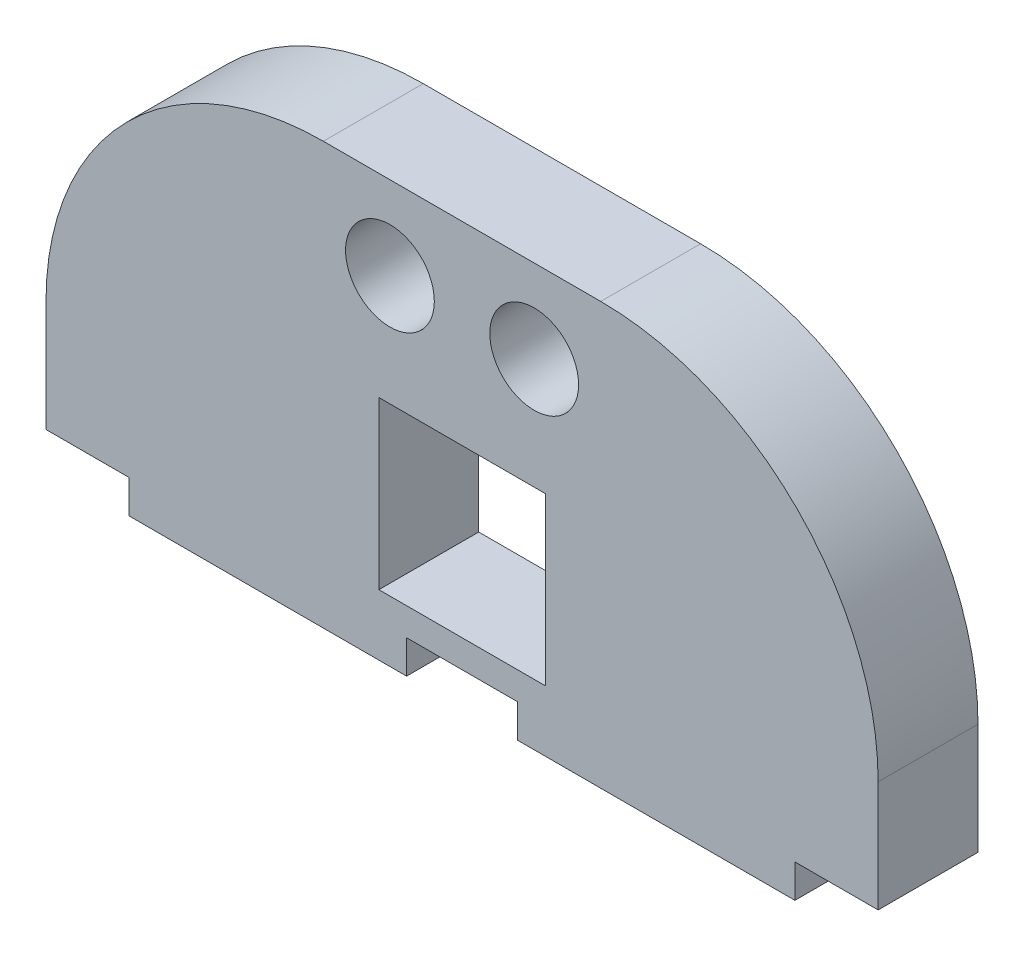
from build123d import *

# Parameters (mm, degrees)
ESQUISSE1_R        = 8
ESQUISSE1_W        = 30
ESQUISSE1_H        = 30
BOSS_EXTRU_1_DEPTH = 18


with BuildPart() as part:
    # Esquisse1 → Boss.-Extru.1 (new body)
    with BuildSketch(Plane.XY):
        with BuildLine():
            Line((0, 0), (0, 20))
            ThreePointArc((0, 20), (14.644660941, 55.355339059), (50, 70))
            Line((50, 70), (100, 70))
            ThreePointArc((100, 70), (135.355339059, 55.355339059), (150, 20))
            Line((150, 20), (150, 0))
            Line((150, 0), (135, 0))
            Line((135, 0), (135, -6))
            Line((135, -6), (85, -6))
            Line((85, -6), (85, 0))
            Line((85, 0), (65, 0))
            Line((65, 0), (65, -6))
            Line((65, -6), (15, -6))
            Line((15, -6), (15, 0))
            Line((15, 0), (0, 0))
        make_face()
        with Locations((62, 55)):
            Circle(ESQUISSE1_R, mode=Mode.SUBTRACT)
        with Locations((88, 55)):
            Circle(ESQUISSE1_R, mode=Mode.SUBTRACT)
        with Locations((75, 20)):
            Rectangle(ESQUISSE1_W, ESQUISSE1_H, mode=Mode.SUBTRACT)
    extrude(amount=BOSS_EXTRU_1_DEPTH)


solid = part.part
